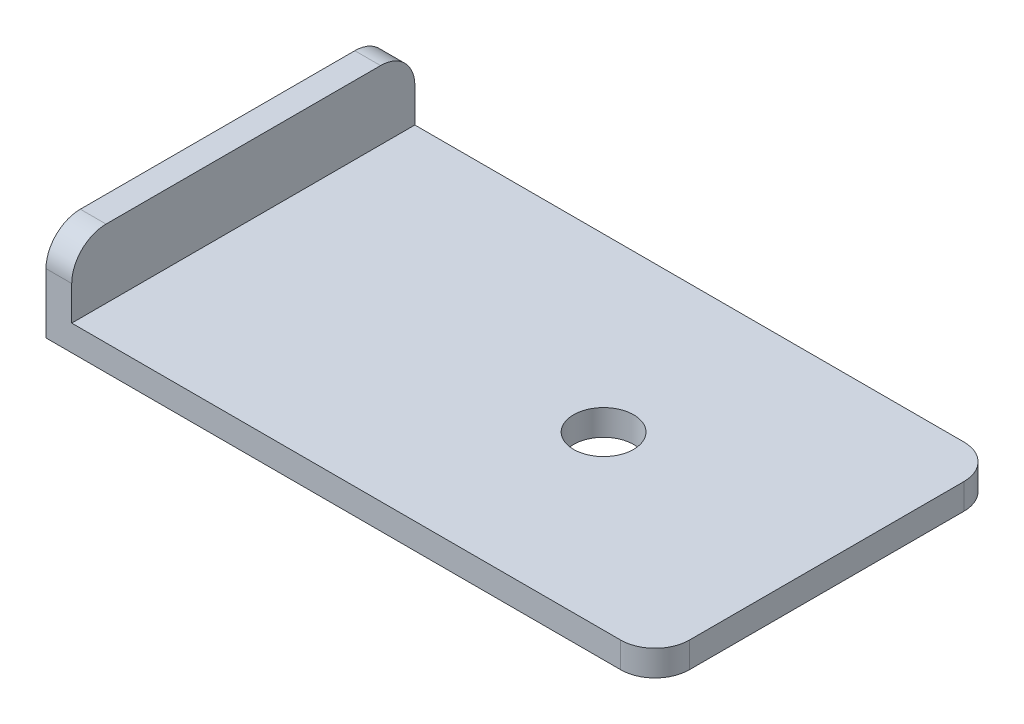
from build123d import *

# Parameters (mm, degrees)
EXTRU_MINCE1_DEPTH      = 20
ESQUISSE2_R             = 1.75
ENL_V_MAT_EXTRU_1_DEPTH = 45.544921147
ESQUISSE3_W             = 1.5
ESQUISSE3_H             = 14
ENL_V_MAT_EXTRU_2_DEPTH = 46.171893916
CONG_1_R                = 2


with BuildPart() as part:
    # Esquisse1 → Extru.-Mince1 (new body)
    with BuildSketch(Plane.XY):
        Polygon((0, 19.5), (0, 0), (35.5, 0), (35.5, 1.5), (1.5, 1.5), (1.5, 19.5), align=None)
    extrude(amount=EXTRU_MINCE1_DEPTH)

    # Esquisse2 → Enlèv. mat.-Extru.1 (cut, through all)
    with BuildSketch(Plane(origin=(0, 1.5, 0), x_dir=(1, 0, 0), z_dir=(0, 1, 0))):
        with Locations(Location((22.5, -10, 0), (0, 0, 270))):
            Circle(ESQUISSE2_R)
    extrude(amount=-ENL_V_MAT_EXTRU_1_DEPTH, mode=Mode.SUBTRACT)

    # Esquisse3 → Enlèv. mat.-Extru.2 (cut, through all)
    with BuildSketch(Plane.XY.offset(20)):
        with Locations((0.75, 12.5)):
            Rectangle(ESQUISSE3_W, ESQUISSE3_H)
    extrude(amount=-ENL_V_MAT_EXTRU_2_DEPTH, mode=Mode.SUBTRACT)

    # Congé1
    cong_1_edges = [part.edges().sort_by_distance(p)[0] for p in [
        (0.75, 5.5, 0),
        (0.75, 5.5, 20),
        (35.5, 0.75, 0),
        (35.5, 0.75, 20),
    ]]
    fillet(cong_1_edges, radius=CONG_1_R)


solid = part.part
